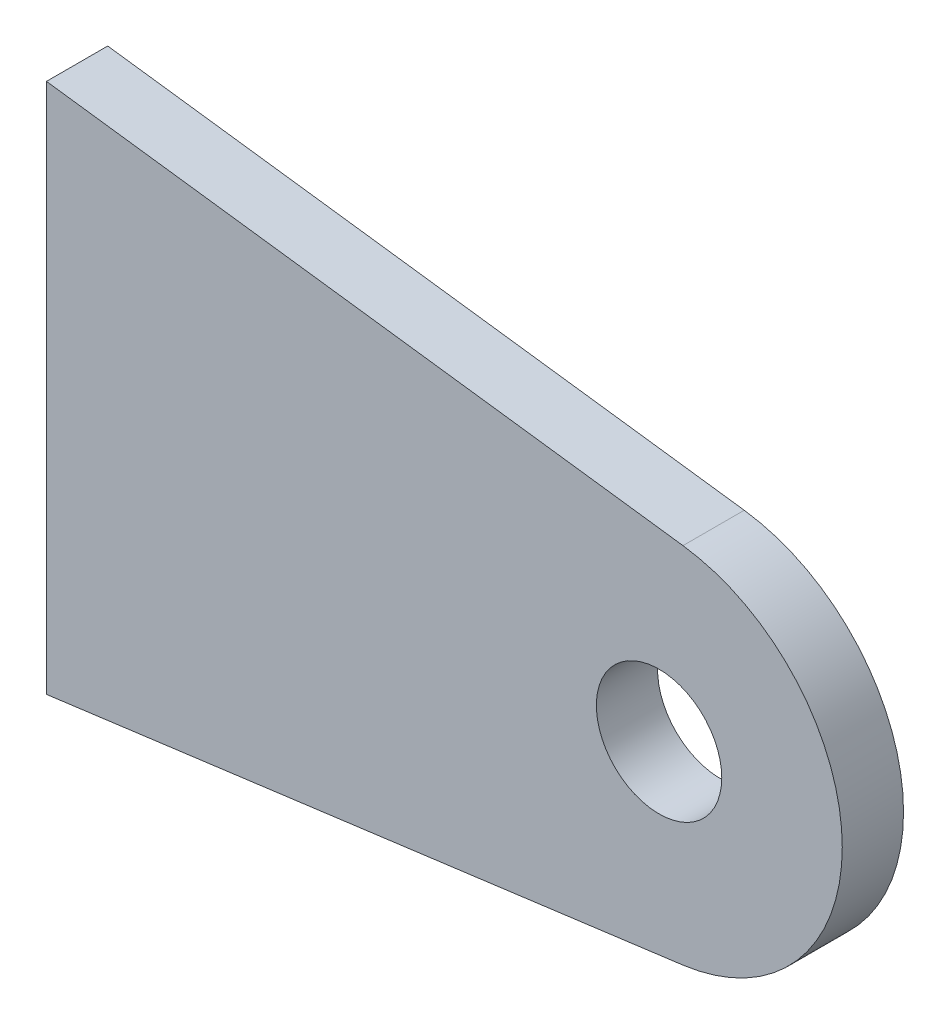
from build123d import *

# Parameters (mm, degrees)
SKETCH1_R           = 3.25
BOSS_EXTRUDE1_DEPTH = 3.175


with BuildPart() as part:
    # Sketch1 → Boss-Extrude1 (new body)
    with BuildSketch(Plane(origin=(-1053.740804459, 0, 0), x_dir=(1, 0, 0), z_dir=(0, 0, 1))):
        with BuildLine():
            Line((1021.990804459, -13.757839033), (1054.980272331, -9.414693193))
            ThreePointArc((1054.980272331, -9.414693193), (1063.236736668, 0), (1054.980272331, 9.414693193))
            Line((1054.980272331, 9.414693193), (1021.990804459, 13.757839033))
            Line((1021.990804459, 13.757839033), (1021.990804459, -13.757839033))
        make_face()
        with Locations((1053.740804459, 0)):
            Circle(SKETCH1_R, mode=Mode.SUBTRACT)
    extrude(amount=BOSS_EXTRUDE1_DEPTH)


solid = part.part
